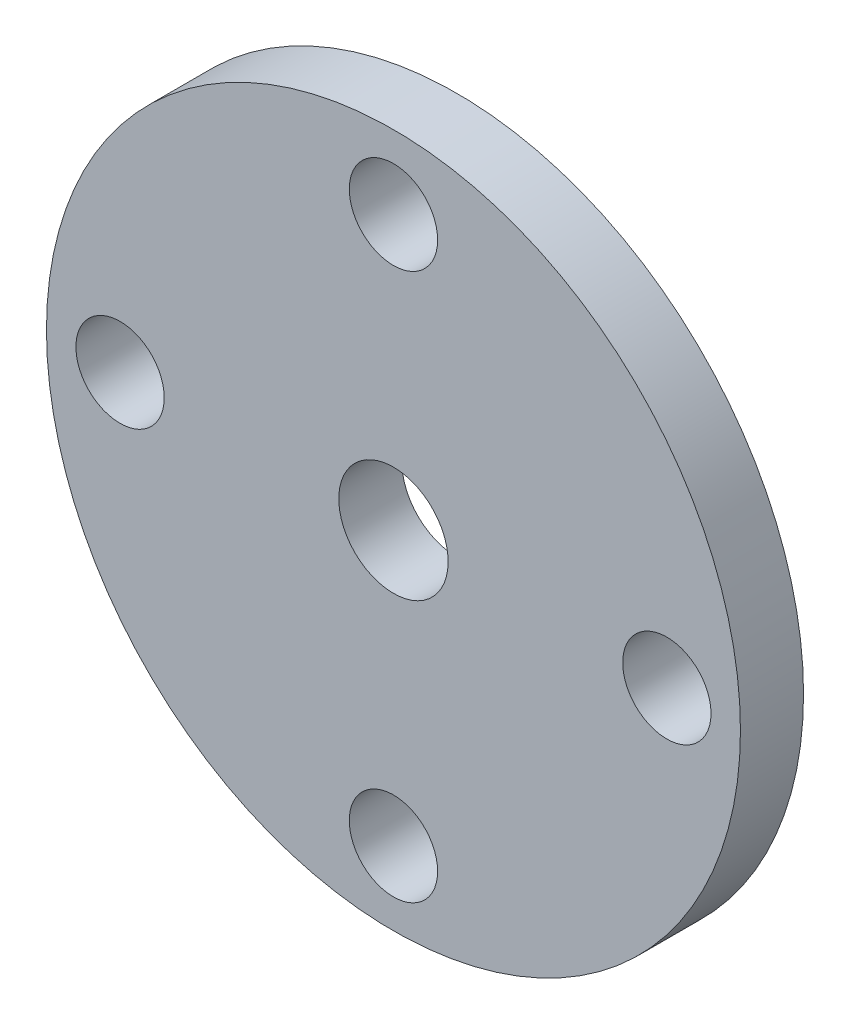
from build123d import *

# Parameters (mm, degrees)
SKETCH_1_R      = 16.5
SKETCH_1_R_2    = 2.1
SKETCH_1_R_3    = 2.6
EXTRUDE_1_DEPTH = 3


with BuildPart() as part:
    # 草图1 → 凸台-拉伸1 (new body)
    with BuildSketch(Plane.XY):
        Circle(SKETCH_1_R)
        with Locations((0, 13)):
            Circle(SKETCH_1_R_2, mode=Mode.SUBTRACT)
        with Locations((13, 0)):
            Circle(SKETCH_1_R_2, mode=Mode.SUBTRACT)
        with Locations((0, -13)):
            Circle(SKETCH_1_R_2, mode=Mode.SUBTRACT)
        with Locations((-13, 0)):
            Circle(SKETCH_1_R_2, mode=Mode.SUBTRACT)
        Circle(SKETCH_1_R_3, mode=Mode.SUBTRACT)
    extrude(amount=EXTRUDE_1_DEPTH)


solid = part.part
